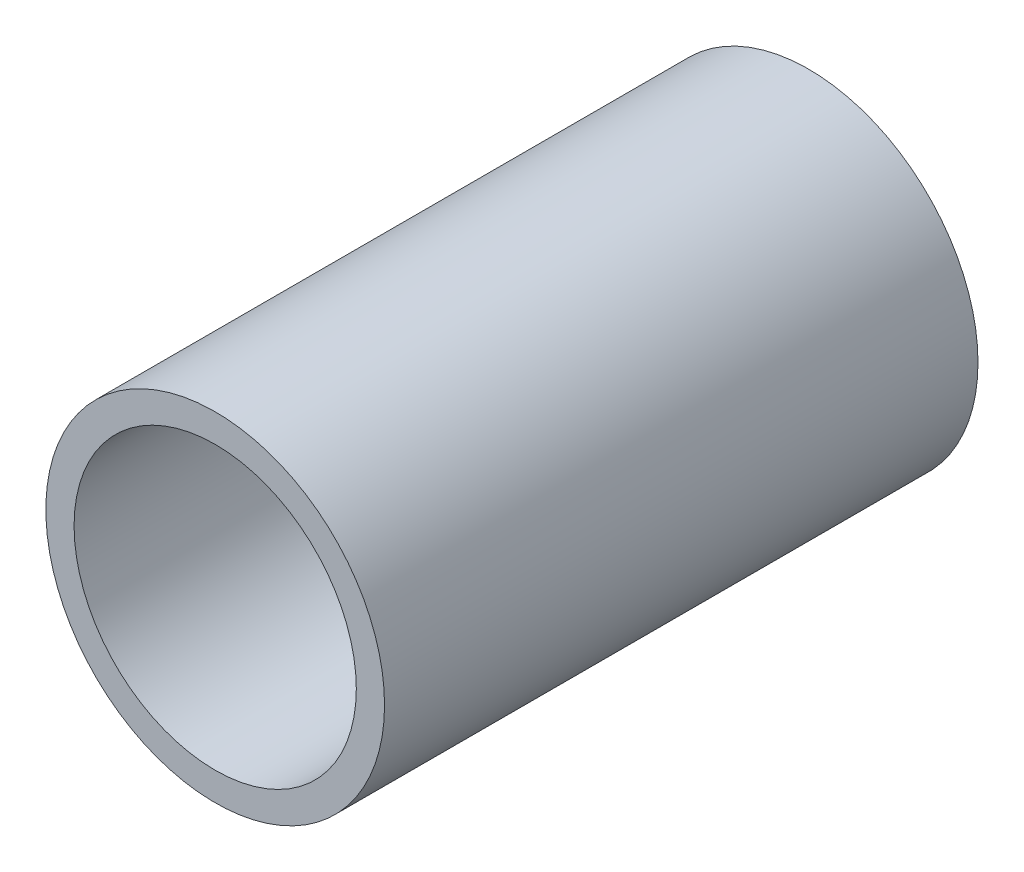
from build123d import *

# Parameters (mm, degrees)
SKETCH1_R           = 9
SKETCH1_R_2         = 7.5
BOSS_EXTRUDE1_DEPTH = 27.5
BOSS_EXTRUDE2_START = 4.04
SKETCH1_3_R         = 9
SKETCH1_3_R_2       = 7.5
BOSS_EXTRUDE2_DEPTH = 4.04


with BuildPart() as part:
    # Sketch1 → Boss-Extrude1 (new body)
    with BuildSketch(Plane.XY):
        Circle(SKETCH1_R)
        Circle(SKETCH1_R_2, mode=Mode.SUBTRACT)
    extrude(amount=-BOSS_EXTRUDE1_DEPTH)

    # Sketch1<3> → Boss-Extrude2 (add)
    with BuildSketch(Plane.XY.offset(BOSS_EXTRUDE2_START)):
        Circle(SKETCH1_3_R)
        Circle(SKETCH1_3_R_2, mode=Mode.SUBTRACT)
    extrude(amount=-BOSS_EXTRUDE2_DEPTH)


solid = part.part
